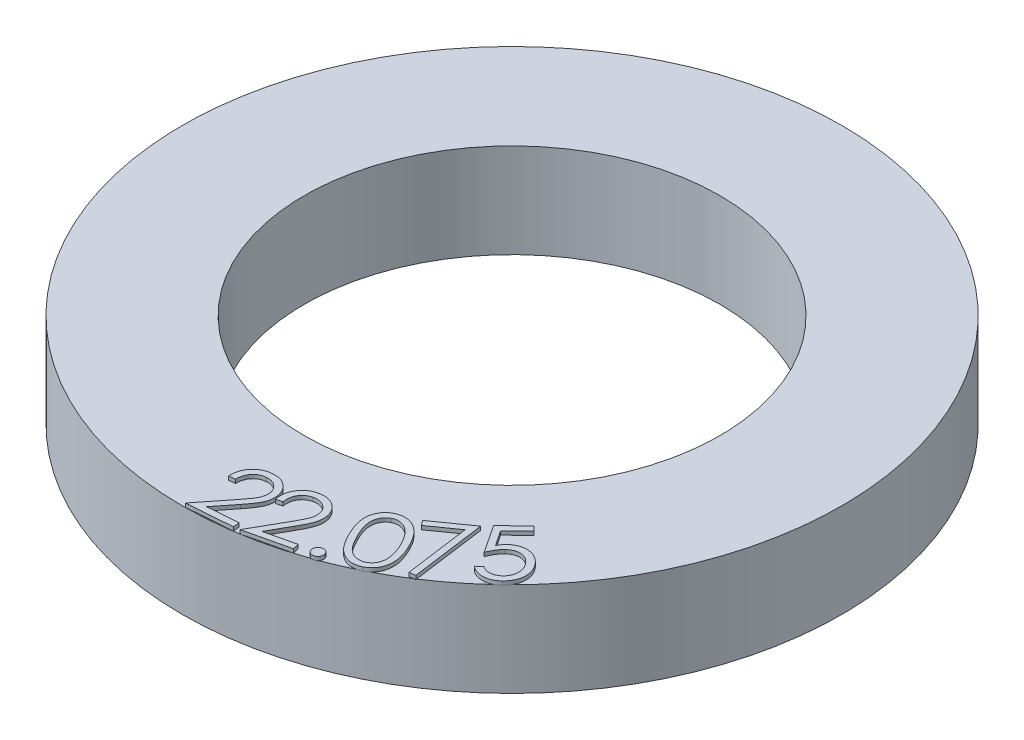
from build123d import *

# Parameters (mm, degrees)
SKETCH1_R           = 17.5
SKETCH1_R_2         = 11.0375
BOSS_EXTRUDE1_DEPTH = 5
BOSS_EXTRUDE4_DEPTH = 0.2


with BuildPart() as part:
    # Sketch1 → Boss-Extrude1 (new body)
    with BuildSketch(Plane(origin=(0, 0, 0), x_dir=(1, 0, 0), z_dir=(0, 1, 0))):
        Circle(SKETCH1_R)
        Circle(SKETCH1_R_2, mode=Mode.SUBTRACT)
    extrude(amount=BOSS_EXTRUDE1_DEPTH)

    # Sketch4 → Boss-Extrude4 (add)
    # profile 1 of 6: a face of its own
    with BuildSketch(Plane(origin=(0, 5, 0), x_dir=(1, 0, 0), z_dir=(0, 1, 0))):
        with BuildLine():
            Line((0.377203526, -15.06640625), (0.043469551, -15.092347756))
            add(Edge.make_bspline(
                [(0.043469551, -15.092347756), (0.042203297, -15.050032699), (0.039723419, -14.96716131), (0.049638285, -14.844981972), (0.067688405, -14.727624407), (0.098455755, -14.61556583), (0.138504263, -14.508522308), (0.188279293, -14.405930448), (0.249943807, -14.309195828), (0.320224245, -14.217586795), (0.399116148, -14.133937543), (0.484222111, -14.059456033), (0.574336923, -13.993992114), (0.671078969, -13.940092371), (0.773224869, -13.895612995), (0.881084602, -13.861423192), (0.994390789, -13.836174987), (1.072362547, -13.828578994), (1.111979167, -13.824719551)],
                knots=[0, 0, 0, 0, 1.099165856, 2.152647473, 3.179901334, 4.180092559, 5.165857059, 6.14623908, 7.136854445, 8.141313093, 9.142222958, 10.119044223, 11.076246807, 12.030555843, 12.990566437, 13.966122304, 14.966608418, 16, 16, 16, 16], degree=3))
            add(Edge.make_bspline(
                [(1.111979167, -13.824719551), (1.151232363, -13.822614291), (1.227892409, -13.818502795), (1.341072803, -13.824300473), (1.449209712, -13.840047194), (1.552456645, -13.867170925), (1.650809554, -13.903432336), (1.744251767, -13.950064736), (1.832189716, -14.007297288), (1.914237577, -14.07371881), (1.989801801, -14.146775331), (2.056191283, -14.225750107), (2.115236363, -14.307662186), (2.163673815, -14.394967734), (2.203994369, -14.485852699), (2.23381166, -14.581483532), (2.256306856, -14.680631266), (2.263224051, -14.74868976), (2.266726763, -14.783153045)],
                knots=[0, 0, 0, 0, 1.125255338, 2.197582177, 3.23984224, 4.249678898, 5.249348258, 6.237204937, 7.234226399, 8.248247252, 9.256507582, 10.239567543, 11.199778339, 12.143800945, 13.093950023, 14.042329097, 15.008679649, 16, 16, 16, 16], degree=3))
            add(Edge.make_bspline(
                [(2.266726763, -14.783153045), (2.268653871, -14.83201524), (2.272472697, -14.928842275), (2.256591946, -15.073272294), (2.221554197, -15.213909987), (2.177756368, -15.329043673), (2.13210079, -15.422970742), (2.088829613, -15.499650514), (2.039151976, -15.583479859), (1.980752569, -15.67318269), (1.913642882, -15.76882397), (1.840613729, -15.872212721), (1.757921696, -15.980725817), (1.700055339, -16.055042687), (1.670072115, -16.093549679)],
                knots=[0, 0, 0, 0, 1.190284496, 2.358709392, 3.525773572, 4.713480732, 5.352743619, 6.06901355, 6.858115264, 7.726847504, 8.676217017, 9.704931629, 10.810819393, 12, 12, 12, 12], degree=3))
            Line((1.670072115, -16.093549679), (0.875701122, -17.094751603))
            Line((0.875701122, -17.094751603), (2.482672276, -16.971354167))
            Line((2.482672276, -16.971354167), (2.508613782, -17.307191506))
            Line((2.508613782, -17.307191506), (0.14443109, -17.488782051))
            Line((0.14443109, -17.488782051), (1.363681891, -15.949819712))
            add(Edge.make_bspline(
                [(1.363681891, -15.949819712), (1.393527022, -15.912554926), (1.450782044, -15.841066007), (1.530584566, -15.73612355), (1.602999147, -15.639675593), (1.666852925, -15.550639363), (1.722438282, -15.469396851), (1.76961629, -15.395481899), (1.809021619, -15.329602995), (1.849329165, -15.251857602), (1.888211722, -15.159145837), (1.917541309, -15.046099013), (1.933704742, -14.93175562), (1.93042781, -14.855174346), (1.928786058, -14.816806891)],
                knots=[0, 0, 0, 0, 1.323859622, 2.539697786, 3.655679983, 4.668207506, 5.577749991, 6.384956845, 7.099630202, 7.705429782, 8.812646299, 9.878423536, 10.93708365, 12, 12, 12, 12], degree=3))
            add(Edge.make_bspline(
                [(1.928786058, -14.816806891), (1.92620974, -14.792668697), (1.921140936, -14.745177743), (1.905685163, -14.675960851), (1.882668381, -14.610204079), (1.854314913, -14.54686504), (1.818130268, -14.487171166), (1.775716227, -14.430480301), (1.726271651, -14.377301953), (1.671340099, -14.327125852), (1.611934069, -14.281949704), (1.548780398, -14.24375581), (1.483443961, -14.212316408), (1.415907726, -14.186368957), (1.345139571, -14.169292508), (1.271999298, -14.157876025), (1.196114655, -14.153502913), (1.144924611, -14.156323447), (1.118990385, -14.157752404)],
                knots=[0, 0, 0, 0, 1.002985613, 1.973335034, 2.923515741, 3.878986154, 4.836651989, 5.802759845, 6.800988188, 7.833639541, 8.87511098, 9.880838076, 10.878972912, 11.86950441, 12.865345595, 13.881918786, 14.926924211, 16, 16, 16, 16], degree=3))
            add(Edge.make_bspline(
                [(1.118990385, -14.157752404), (1.091811261, -14.160540619), (1.038491161, -14.166010548), (0.960749235, -14.182373159), (0.886899306, -14.205342141), (0.817246391, -14.235736869), (0.751710741, -14.272344942), (0.690146343, -14.315288584), (0.633132276, -14.365692478), (0.580060436, -14.422065975), (0.532383632, -14.484564259), (0.490634628, -14.552362028), (0.455698611, -14.625546395), (0.426899376, -14.703718722), (0.404472482, -14.787020099), (0.388336351, -14.875402791), (0.379467781, -14.969236984), (0.377971809, -15.033435801), (0.377203526, -15.06640625)],
                knots=[0, 0, 0, 0, 1.003856858, 1.969369873, 2.914991585, 3.842326504, 4.757764574, 5.67065914, 6.596081697, 7.550367434, 8.512664105, 9.480773, 10.472199548, 11.488843046, 12.539268398, 13.639696742, 14.787824085, 16, 16, 16, 16], degree=3))
        make_face()
    # profile 2 of 6: a face of its own
    with BuildSketch(Plane(origin=(0, 5, 0), x_dir=(1, 0, 0), z_dir=(0, 1, 0))):
        with BuildLine():
            Line((2.680077799, -14.84254585), (2.355458408, -14.918267004))
            add(Edge.make_bspline(
                [(2.355458408, -14.918267004), (2.347994142, -14.876767046), (2.333387531, -14.795556953), (2.323472579, -14.673990721), (2.324976016, -14.555728299), (2.336513827, -14.440605451), (2.359783356, -14.328975701), (2.394590343, -14.221092867), (2.439601661, -14.116379831), (2.494569659, -14.015576781), (2.559832485, -13.921863348), (2.631188548, -13.834656401), (2.710921768, -13.757361702), (2.797573287, -13.688946733), (2.891342116, -13.629703088), (2.992353062, -13.580084855), (3.099856127, -13.537971321), (3.175300136, -13.518303724), (3.213631485, -13.508311075)],
                knots=[0, 0, 0, 0, 1.100238416, 2.153025381, 3.178012026, 4.183884262, 5.168591255, 6.148695239, 7.138002634, 8.140019377, 9.140121407, 10.114951831, 11.077023251, 12.032670763, 12.99234068, 13.966349905, 14.966749606, 16, 16, 16, 16], degree=3))
            add(Edge.make_bspline(
                [(3.213631485, -13.508311075), (3.251843088, -13.50036415), (3.32664053, -13.484808413), (3.438897548, -13.473770246), (3.547813259, -13.472847982), (3.653615731, -13.482442125), (3.755983303, -13.503477882), (3.854414489, -13.536291351), (3.950096274, -13.578421826), (4.040814221, -13.631584861), (4.126003653, -13.692404589), (4.204208412, -13.758970295), (4.274030899, -13.831494589), (4.335160407, -13.90960072), (4.388361962, -13.993145467), (4.432982751, -14.082231672), (4.470178835, -14.176708828), (4.487307474, -14.242643219), (4.495983248, -14.27603944)],
                knots=[0, 0, 0, 0, 1.121990491, 2.196244399, 3.238232453, 4.250969426, 5.246356061, 6.236987075, 7.230101134, 8.248200839, 9.255501669, 10.237657177, 11.19803806, 12.146105858, 13.086011545, 14.042029985, 15.008274769, 16, 16, 16, 16], degree=3))
            add(Edge.make_bspline(
                [(4.495983248, -14.27603944), (4.505415824, -14.323774993), (4.524110077, -14.41838123), (4.529985585, -14.56283772), (4.516844757, -14.706380405), (4.49162199, -14.826395359), (4.460506924, -14.925374116), (4.431085731, -15.007919873), (4.393488718, -15.097141834), (4.349829317, -15.194418504), (4.299347185, -15.299042154), (4.242538162, -15.411720311), (4.177915647, -15.531101044), (4.131979942, -15.612908193), (4.108262895, -15.655146011)],
                knots=[0, 0, 0, 0, 1.190223456, 2.358882579, 3.52524119, 4.712819824, 5.35365978, 6.065105631, 6.857984567, 7.723828008, 8.67607557, 9.702436758, 10.813745988, 12, 12, 12, 12], degree=3))
            Line((4.108262895, -15.655146011), (3.479356645, -16.761516203))
            Line((3.479356645, -16.761516203), (5.041456004, -16.394829504))
            Line((5.041456004, -16.394829504), (5.11787828, -16.721552261))
            Line((5.11787828, -16.721552261), (2.819601036, -17.260714921))
            Line((2.819601036, -17.260714921), (3.785045748, -15.56119569))
            add(Edge.make_bspline(
                [(3.785045748, -15.56119569), (3.808529371, -15.519892567), (3.8536226, -15.440582352), (3.91665988, -15.325551236), (3.973290102, -15.219474376), (4.021957514, -15.121779814), (4.064311127, -15.032979861), (4.100364837, -14.953571722), (4.128654637, -14.882434307), (4.156784414, -14.800101176), (4.179688984, -14.702577351), (4.192972915, -14.587024863), (4.189968714, -14.471889792), (4.175230987, -14.396958355), (4.167858248, -14.359472934)],
                knots=[0, 0, 0, 0, 1.322508168, 2.539478858, 3.65113322, 4.669382137, 5.577246142, 6.389686428, 7.096378664, 7.707362647, 8.810322298, 9.877140803, 10.938012216, 12, 12, 12, 12], degree=3))
            add(Edge.make_bspline(
                [(4.167858248, -14.359472934), (4.161829404, -14.336171476), (4.149935411, -14.290201239), (4.123387221, -14.224893717), (4.091995869, -14.16328915), (4.053584185, -14.106135055), (4.009399893, -14.052600205), (3.95860095, -14.003544562), (3.901957352, -13.958350343), (3.840235373, -13.917568468), (3.775029978, -13.881814057), (3.707248163, -13.853637752), (3.637912338, -13.832678602), (3.56741324, -13.817301491), (3.494890393, -13.811664684), (3.421495235, -13.811468351), (3.346244991, -13.818247864), (3.296509601, -13.82889709), (3.271123472, -13.834332709)],
                knots=[0, 0, 0, 0, 0.998805992, 1.97049261, 2.921394182, 3.866479787, 4.824835265, 5.799717433, 6.794315519, 7.830951375, 8.869177059, 9.878822869, 10.873799922, 11.875291578, 12.869368348, 13.888722291, 14.922353531, 16, 16, 16, 16], degree=3))
            add(Edge.make_bspline(
                [(3.271123472, -13.834332709), (3.244792519, -13.841064204), (3.193002937, -13.854304184), (3.119061623, -13.882705923), (3.050115946, -13.91714881), (2.986034959, -13.957311139), (2.926579811, -14.002814596), (2.87305675, -14.05555418), (2.823928987, -14.113545846), (2.780414933, -14.177443519), (2.743380272, -14.246402199), (2.712244756, -14.319205359), (2.689061885, -14.396615139), (2.673136557, -14.477873433), (2.664009273, -14.563501926), (2.662180891, -14.653056839), (2.666949138, -14.746824786), (2.675629023, -14.810109822), (2.680077799, -14.84254585)],
                knots=[0, 0, 0, 0, 1.001857296, 1.97052376, 2.915105733, 3.840812044, 4.756468097, 5.670946457, 6.606992161, 7.556283339, 8.516782409, 9.490308786, 10.47212129, 11.491627338, 12.540773751, 13.644567144, 14.792749573, 16, 16, 16, 16], degree=3))
        make_face()
    # profile 3 of 6: a face of its own
    with BuildSketch(Plane(origin=(0, 5, 0), x_dir=(1, 0, 0), z_dir=(0, 1, 0))):
        with BuildLine():
            add(Edge.make_bspline(
                [(5.812610444, -15.938128556), (5.831374417, -15.932374898), (5.868100028, -15.921113607), (5.925587729, -15.918820778), (5.982023209, -15.927326543), (6.036365652, -15.947186897), (6.086750753, -15.976062519), (6.129683552, -16.014781695), (6.164195697, -16.061839206), (6.179302393, -16.097844445), (6.187009483, -16.116213491)],
                knots=[0, 0, 0, 0, 1.018533362, 1.993514881, 2.966138152, 3.9748784, 4.989476654, 5.972026843, 6.965374611, 8, 8, 8, 8], degree=3))
            add(Edge.make_bspline(
                [(6.187009483, -16.116213491), (6.192680674, -16.134982532), (6.203852009, -16.171954526), (6.207259114, -16.229869607), (6.198423544, -16.286997519), (6.178873974, -16.341926891), (6.149719297, -16.392227049), (6.111823907, -16.435344643), (6.065578658, -16.469979456), (6.029886494, -16.484584723), (6.011729034, -16.492014773)],
                knots=[0, 0, 0, 0, 1.018247088, 2.005783202, 2.990165439, 4.010083513, 5.024396598, 5.998572224, 6.981825626, 8, 8, 8, 8], degree=3))
            add(Edge.make_bspline(
                [(6.011729034, -16.492014773), (5.992964701, -16.497770106), (5.956238387, -16.509034678), (5.898755786, -16.511303732), (5.842003107, -16.502843983), (5.787364663, -16.482393394), (5.737095106, -16.452595757), (5.694096527, -16.414271405), (5.660232144, -16.367416245), (5.645083379, -16.332037335), (5.637329996, -16.313929838)],
                knots=[0, 0, 0, 0, 1.019327242, 1.995068695, 2.968450063, 3.99358383, 5.015165017, 5.99848104, 6.975590248, 8, 8, 8, 8], degree=3))
            add(Edge.make_bspline(
                [(5.637329996, -16.313929838), (5.63125142, -16.294941947), (5.619366426, -16.257816312), (5.617673921, -16.1996281), (5.624612676, -16.142442807), (5.645777227, -16.087974496), (5.675371175, -16.038150206), (5.712952105, -15.994657098), (5.759716127, -15.961248414), (5.794765915, -15.945928316), (5.812610444, -15.938128556)],
                knots=[0, 0, 0, 0, 1.033330105, 2.02039479, 3.003248301, 4.016090021, 5.036799157, 6.01117572, 6.98745084, 8, 8, 8, 8], degree=3))
        make_face()
    # profile 4 of 6: a face of its own
    with BuildSketch(Plane(origin=(0, 5, 0), x_dir=(1, 0, 0), z_dir=(0, 1, 0))):
        with BuildLine():
            add(Edge.make_bspline(
                [(5.926947455, -14.591409929), (5.902562604, -14.54107518), (5.85522936, -14.443370795), (5.79150997, -14.298815349), (5.73552527, -14.161061187), (5.68880451, -14.029731846), (5.649785175, -13.905181613), (5.619188564, -13.787581207), (5.598248206, -13.676253217), (5.584287385, -13.571155334), (5.57919627, -13.47108959), (5.578665054, -13.375088526), (5.585236468, -13.282599638), (5.596759429, -13.193244945), (5.615243522, -13.107554057), (5.638984629, -13.024937828), (5.669080659, -12.945939741), (5.705037952, -12.870486318), (5.746241388, -12.799320862), (5.792128244, -12.732441223), (5.841764309, -12.669637867), (5.896918, -12.611949163), (5.956348177, -12.558875199), (6.020054728, -12.510092605), (6.08799113, -12.46547704), (6.13657505, -12.440412141), (6.161122135, -12.42774807)],
                knots=[0, 0, 0, 0, 1.645123066, 3.193335451, 4.646111031, 6.018177867, 7.292391992, 8.484572827, 9.590181928, 10.622806741, 11.60056216, 12.535521377, 13.445088631, 14.32596282, 15.183511051, 16.021124921, 16.852309999, 17.667186738, 18.477264483, 19.268601895, 20.051291864, 20.829318415, 21.613184976, 22.392819618, 23.187970152, 24, 24, 24, 24], degree=3))
            add(Edge.make_bspline(
                [(6.161122135, -12.42774807), (6.186416897, -12.41586994), (6.236684693, -12.392264759), (6.314501335, -12.36470959), (6.393107517, -12.342410836), (6.472661692, -12.327239889), (6.553271877, -12.31802542), (6.634653285, -12.314965493), (6.716867714, -12.319760089), (6.799919287, -12.329168963), (6.883174943, -12.34608104), (6.966155539, -12.37003131), (7.048434116, -12.401004867), (7.130041398, -12.439298027), (7.211645957, -12.48399607), (7.291888095, -12.537079899), (7.372445514, -12.595899887), (7.451524623, -12.663226038), (7.53177806, -12.737252896), (7.608868058, -12.82306367), (7.687194006, -12.916651425), (7.763230912, -13.021265261), (7.839890412, -13.134520908), (7.914580255, -13.258417499), (7.989117127, -13.391622555), (8.036262527, -13.484859722), (8.060461077, -13.532716019)],
                knots=[0, 0, 0, 0, 0.815522942, 1.620673105, 2.407127251, 3.199421702, 3.982404283, 4.774463597, 5.573925633, 6.384810166, 7.21322184, 8.051218599, 8.904223805, 9.7773812, 10.681457269, 11.618366128, 12.584685123, 13.592104133, 14.649390235, 15.769905354, 16.957308209, 18.211614585, 19.544051311, 20.949621683, 22.434317369, 24, 24, 24, 24], degree=3))
            add(Edge.make_bspline(
                [(8.060461077, -13.532716019), (8.083676138, -13.580713633), (8.128993329, -13.674407851), (8.189986589, -13.813715623), (8.242569299, -13.947824566), (8.287954881, -14.076234074), (8.324531496, -14.199551885), (8.352671313, -14.31777949), (8.373480479, -14.430525051), (8.385322509, -14.538568758), (8.390320998, -14.641835648), (8.388887915, -14.741112208), (8.381864174, -14.836623314), (8.369763594, -14.928867051), (8.349831198, -15.017102648), (8.32452604, -15.101672159), (8.293824693, -15.182756182), (8.256422815, -15.259593676), (8.214636304, -15.33273874), (8.167170913, -15.400767195), (8.116455338, -15.464808393), (8.060066422, -15.523313135), (8.000349089, -15.578371457), (7.93440333, -15.627080401), (7.865231211, -15.672537356), (7.816007071, -15.698189525), (7.791230308, -15.711101436)],
                knots=[0, 0, 0, 0, 1.558232882, 3.041763995, 4.443401513, 5.767654612, 7.021227995, 8.200860323, 9.318297212, 10.369822129, 11.375069383, 12.33829166, 13.269771564, 14.172997789, 15.054657955, 15.910430237, 16.751491526, 17.585533636, 18.405670074, 19.210937023, 20.007816759, 20.79051811, 21.583582897, 22.378674821, 23.183912799, 24, 24, 24, 24], degree=3))
            add(Edge.make_bspline(
                [(7.791230308, -15.711101436), (7.766431263, -15.723049141), (7.717237552, -15.746749729), (7.640310472, -15.773330086), (7.563501911, -15.795698202), (7.485255082, -15.810196549), (7.406564328, -15.819379889), (7.326812105, -15.822494414), (7.246466062, -15.817645125), (7.165277192, -15.808308799), (7.084054508, -15.791536491), (7.003686605, -15.76703736), (6.923501898, -15.737517425), (6.844908293, -15.698666716), (6.766125548, -15.654780159), (6.688246546, -15.603267844), (6.611014094, -15.544912142), (6.534220148, -15.479151896), (6.456832329, -15.405441295), (6.381864903, -15.319672676), (6.304752618, -15.225276524), (6.229634456, -15.118649086), (6.153134594, -15.002369804), (6.076551088, -14.875315765), (6.001358636, -14.737010675), (5.952205998, -14.640833451), (5.926947455, -14.591409929)],
                knots=[0, 0, 0, 0, 0.809697074, 1.60619104, 2.392486736, 3.162970989, 3.945555516, 4.723499003, 5.508921287, 6.312809801, 7.127809543, 7.946286757, 8.784564208, 9.640029567, 10.524148465, 11.438198645, 12.386286821, 13.372094412, 14.413385884, 15.529264195, 16.723043957, 18.000326053, 19.366637222, 20.82031953, 22.366026776, 24, 24, 24, 24], degree=3))
        make_face()
        with BuildLine():
            add(Edge.make_bspline(
                [(6.22562534, -14.45118557), (6.247152486, -14.493827643), (6.288803655, -14.576332411), (6.35272169, -14.694479999), (6.415628804, -14.802963612), (6.477380889, -14.902249227), (6.538074292, -14.992095397), (6.598302452, -15.072064949), (6.657300152, -15.142495557), (6.715154253, -15.20428425), (6.773356993, -15.258295423), (6.832211594, -15.305661688), (6.891283645, -15.348442721), (6.951848821, -15.38466198), (7.01274857, -15.416545018), (7.074663848, -15.442555872), (7.137258339, -15.463081318), (7.220515336, -15.482234019), (7.323218316, -15.494762827), (7.443001609, -15.490442581), (7.557614302, -15.469311729), (7.627402949, -15.438375811), (7.662223898, -15.422940378)],
                knots=[0, 0, 0, 0, 1.478025749, 2.859714887, 4.155866294, 5.357813273, 6.477029825, 7.509705812, 8.454142307, 9.318703752, 10.127220785, 10.908768663, 11.655271175, 12.382037597, 13.090364968, 13.780707852, 14.457625429, 15.125951693, 16.422103099, 17.645012841, 18.824982443, 20, 20, 20, 20], degree=3))
            add(Edge.make_bspline(
                [(7.662223898, -15.422940378), (7.695666028, -15.404167702), (7.762262313, -15.366784004), (7.849830918, -15.290711031), (7.923556971, -15.19859189), (7.975453415, -15.111638599), (8.009498706, -15.035307025), (8.030955763, -14.973978081), (8.045692424, -14.909427994), (8.057351835, -14.842303984), (8.063428775, -14.772191044), (8.064728732, -14.699121437), (8.061335756, -14.623220526), (8.055185686, -14.571981636), (8.052047616, -14.545837013)],
                knots=[0, 0, 0, 0, 1.340731954, 2.669918642, 4.031505281, 5.459277207, 6.2031686, 6.956503628, 7.73084967, 8.519472747, 9.341382062, 10.192884166, 11.077919835, 12, 12, 12, 12], degree=3))
            add(Edge.make_bspline(
                [(8.052047616, -14.545837013), (8.047542123, -14.512816325), (8.038356813, -14.44549733), (8.016640203, -14.343855874), (7.990145068, -14.239492631), (7.957765528, -14.132843356), (7.919616276, -14.023950886), (7.876351819, -13.91243756), (7.826277247, -13.798749286), (7.78959367, -13.722843789), (7.770897776, -13.684158327)],
                knots=[0, 0, 0, 0, 0.87813012, 1.790236412, 2.737444307, 3.715690557, 4.726763541, 5.778019856, 6.867561238, 8, 8, 8, 8], degree=3))
            add(Edge.make_bspline(
                [(7.770897776, -13.684158327), (7.751495288, -13.645943616), (7.713480783, -13.571071088), (7.654007285, -13.463559032), (7.594322423, -13.362519752), (7.533558645, -13.269082417), (7.472338944, -13.182085344), (7.41031568, -13.102536152), (7.347516997, -13.02984651), (7.284739052, -12.96389037), (7.221094369, -12.904952382), (7.158429057, -12.851090127), (7.094461394, -12.805095916), (7.031004629, -12.764865341), (6.968161982, -12.729991873), (6.904313039, -12.702753809), (6.840990823, -12.680572129), (6.757483054, -12.661740495), (6.655825475, -12.649226099), (6.537337092, -12.652317621), (6.424111869, -12.674071923), (6.354886924, -12.704301144), (6.320276782, -12.719414737)],
                knots=[0, 0, 0, 0, 1.327514374, 2.600944907, 3.805270884, 4.961891585, 6.052582967, 7.099609732, 8.08508515, 9.027220953, 9.918472679, 10.771259012, 11.585082234, 12.356317507, 13.09818, 13.808277843, 14.504248721, 15.173304686, 16.456493135, 17.666030037, 18.833093612, 20, 20, 20, 20], degree=3))
            add(Edge.make_bspline(
                [(6.320276782, -12.719414737), (6.286741276, -12.738087308), (6.219690272, -12.775421308), (6.132990995, -12.853606532), (6.056973433, -12.945724965), (6.005166709, -13.034477487), (5.970770692, -13.111929614), (5.949945228, -13.174009348), (5.933000712, -13.238371264), (5.921010975, -13.305655266), (5.914160476, -13.375737952), (5.91203772, -13.448600845), (5.915302483, -13.524183102), (5.921847264, -13.603197497), (5.935722059, -13.687026049), (5.956180897, -13.776661244), (5.983906988, -13.872967535), (6.018289256, -13.975888076), (6.060009389, -14.085445407), (6.10837012, -14.201666646), (6.163943113, -14.32457598), (6.204611149, -14.408051619), (6.22562534, -14.45118557)],
                knots=[0, 0, 0, 0, 1.184359405, 2.368012177, 3.585550163, 4.869153856, 5.53289479, 6.205207044, 6.892746875, 7.590628501, 8.317360586, 9.069723882, 9.844008581, 10.657130917, 11.521409538, 12.470468649, 13.500510027, 14.621004524, 15.827064187, 17.127021726, 18.515460256, 20, 20, 20, 20], degree=3))
        make_face(mode=Mode.SUBTRACT)
    # profile 5 of 6: a face of its own
    with BuildSketch(Plane(origin=(0, 5, 0), x_dir=(1, 0, 0), z_dir=(0, 1, 0))):
        Polygon((7.247667499, -11.988691345), (9.046746025, -10.715454165), (9.587310929, -14.697124838), (9.269001634, -14.741996633), (8.796445544, -11.294580768), (7.436970384, -12.25651987), align=None)
    # profile 6 of 6: a face of its own
    with BuildSketch(Plane(origin=(0, 5, 0), x_dir=(1, 0, 0), z_dir=(0, 1, 0))):
        with BuildLine():
            Line((10.452754524, -9.291042604), (10.68552696, -9.530826258))
            Line((10.68552696, -9.530826258), (9.789493306, -10.399516162))
            Line((9.789493306, -10.399516162), (10.327954844, -11.205105104))
            add(Edge.make_bspline(
                [(10.327954844, -11.205105104), (10.347405355, -11.172122652), (10.385204959, -11.108025431), (10.446885728, -11.0193262), (10.509702256, -10.939697419), (10.555405561, -10.893202352), (10.577554203, -10.870670008)],
                knots=[0, 0, 0, 0, 1.0972362, 2.132339663, 3.094898282, 4, 4, 4, 4], degree=3))
            add(Edge.make_bspline(
                [(10.577554203, -10.870670008), (10.606317416, -10.844200281), (10.662747921, -10.792269364), (10.753702799, -10.724629144), (10.848024177, -10.668009567), (10.945991502, -10.62309149), (11.04674006, -10.588531661), (11.150525188, -10.564262159), (11.257758966, -10.552017687), (11.36719103, -10.549746582), (11.476645925, -10.558902183), (11.583969895, -10.578635191), (11.688412673, -10.608797506), (11.789577002, -10.650442128), (11.88756755, -10.702847316), (11.982623387, -10.765422339), (12.074164549, -10.839462139), (12.130996143, -10.895414044), (12.159986094, -10.923955265)],
                knots=[0, 0, 0, 0, 1.056660519, 2.073060671, 3.059518756, 4.02677442, 4.98224816, 5.935943106, 6.903425925, 7.895980916, 8.891750929, 9.868685659, 10.842855965, 11.826495158, 12.821843791, 13.84390824, 14.900171671, 16, 16, 16, 16], degree=3))
            add(Edge.make_bspline(
                [(12.159986094, -10.923955265), (12.179371474, -10.944790443), (12.217879566, -10.986178488), (12.27122311, -11.051190736), (12.319127373, -11.119122899), (12.362370005, -11.188926824), (12.401443021, -11.260839418), (12.434751195, -11.335040663), (12.463945876, -11.411244998), (12.48736708, -11.489374708), (12.506429447, -11.568206729), (12.519773102, -11.646915148), (12.527677962, -11.725163122), (12.529442244, -11.802697072), (12.527212836, -11.879846664), (12.517429582, -11.956344907), (12.503941494, -12.032619884), (12.48378444, -12.107875306), (12.459677752, -12.18213013), (12.429283702, -12.254748742), (12.393111387, -12.325269634), (12.353457012, -12.395471186), (12.306878168, -12.462802716), (12.256204782, -12.529296219), (12.200270131, -12.593980231), (12.159104301, -12.634499511), (12.138251319, -12.655024976)],
                knots=[0, 0, 0, 0, 1.055652629, 2.097001478, 3.117016048, 4.137178009, 5.141932989, 6.150831921, 7.15243954, 8.167281964, 9.17461492, 10.159572065, 11.126698888, 12.089462946, 13.035170943, 13.986940597, 14.947789716, 15.906759268, 16.874624253, 17.842372723, 18.823391324, 19.813866479, 20.831113527, 21.857739712, 22.91481563, 24, 24, 24, 24], degree=3))
            add(Edge.make_bspline(
                [(12.138251319, -12.655024976), (12.112728931, -12.678884978), (12.062572626, -12.725774383), (11.981204616, -12.786743559), (11.897891282, -12.839563216), (11.81168422, -12.883702587), (11.722425767, -12.917787042), (11.630937819, -12.943862727), (11.536875372, -12.961812787), (11.440809295, -12.969665841), (11.344361381, -12.970104026), (11.249100137, -12.960666604), (11.15568141, -12.943230755), (11.064168704, -12.917126414), (10.974739633, -12.88265442), (10.887481161, -12.839323474), (10.801350171, -12.788490568), (10.74732779, -12.747875068), (10.719881928, -12.727240521)],
                knots=[0, 0, 0, 0, 1.074988754, 2.112555675, 3.124661908, 4.109336649, 5.08879237, 6.06132568, 7.03505602, 8.031750268, 9.024697533, 10.000552301, 10.974282641, 11.946815951, 12.926271671, 13.920599676, 14.943568705, 16, 16, 16, 16], degree=3))
            Line((10.719881928, -12.727240521), (10.977894748, -12.477641162))
            add(Edge.make_bspline(
                [(10.977894748, -12.477641162), (11.005569592, -12.495806132), (11.058958533, -12.530849094), (11.142274933, -12.571307457), (11.223303732, -12.601834409), (11.303835464, -12.619418621), (11.384206354, -12.626812892), (11.465592515, -12.622543133), (11.548546659, -12.610395006), (11.631541431, -12.586678649), (11.713315566, -12.555227199), (11.79003461, -12.513203013), (11.863081375, -12.465249111), (11.905744814, -12.425918472), (11.927213658, -12.406126739)],
                knots=[0, 0, 0, 0, 1.146609473, 2.21198236, 3.203991316, 4.141735567, 5.06091789, 5.993607636, 6.960785206, 7.9613937, 8.980047274, 9.991456537, 10.989272553, 12, 12, 12, 12], degree=3))
            add(Edge.make_bspline(
                [(11.927213658, -12.406126739), (11.947116828, -12.386005376), (11.986402209, -12.346289317), (12.035962279, -12.279596876), (12.078460887, -12.209980418), (12.112896717, -12.13660745), (12.140008149, -12.059672512), (12.157877371, -11.97865727), (12.168483663, -11.893913963), (12.170909111, -11.806404543), (12.166734501, -11.718027891), (12.151985482, -11.63131791), (12.130873661, -11.546673074), (12.099180165, -11.465112367), (12.060839275, -11.385488303), (12.013270909, -11.308543182), (11.957268088, -11.234236594), (11.914534234, -11.187928511), (11.892858691, -11.16444004)],
                knots=[0, 0, 0, 0, 0.981100706, 1.936521514, 2.875413226, 3.807837019, 4.744062615, 5.700309258, 6.681141738, 7.70357785, 8.73517306, 9.745864638, 10.751074282, 11.75729772, 12.776576466, 13.814275091, 14.891352574, 16, 16, 16, 16], degree=3))
            add(Edge.make_bspline(
                [(11.892858691, -11.16444004), (11.872137928, -11.144234653), (11.831654893, -11.104758529), (11.766668116, -11.052287247), (11.699295697, -11.008320363), (11.630215196, -10.970995498), (11.558251382, -10.94312445), (11.484493288, -10.922701854), (11.40860198, -10.909885054), (11.331322757, -10.905282683), (11.253452672, -10.907508432), (11.176677684, -10.919966679), (11.101316048, -10.939681012), (11.027016104, -10.966980311), (10.954630799, -11.003921394), (10.883856199, -11.049188603), (10.813827289, -11.101765043), (10.770241753, -11.142289868), (10.7479268, -11.163037797)],
                knots=[0, 0, 0, 0, 1.076879693, 2.103945646, 3.102811146, 4.067885311, 5.020966591, 5.968553643, 6.912420025, 7.879921856, 8.846132302, 9.805780904, 10.767910189, 11.742270505, 12.745972787, 13.786107055, 14.866529529, 16, 16, 16, 16], degree=3))
            add(Edge.make_bspline(
                [(10.7479268, -11.163037797), (10.72944525, -11.18196967), (10.691371943, -11.220970676), (10.637581559, -11.285710865), (10.585073113, -11.357609334), (10.533131962, -11.436086725), (10.482779483, -11.521834294), (10.43353593, -11.614646619), (10.386263425, -11.714834238), (10.356045618, -11.784382409), (10.340575037, -11.819988919)],
                knots=[0, 0, 0, 0, 0.816012069, 1.681042897, 2.593913321, 3.56181962, 4.583248113, 5.660561185, 6.802279776, 8, 8, 8, 8], degree=3))
            Line((10.340575037, -11.819988919), (9.363912376, -10.346230906))
            Line((9.363912376, -10.346230906), (10.452754524, -9.291042604))
        make_face()
    extrude(amount=BOSS_EXTRUDE4_DEPTH)


solid = part.part
